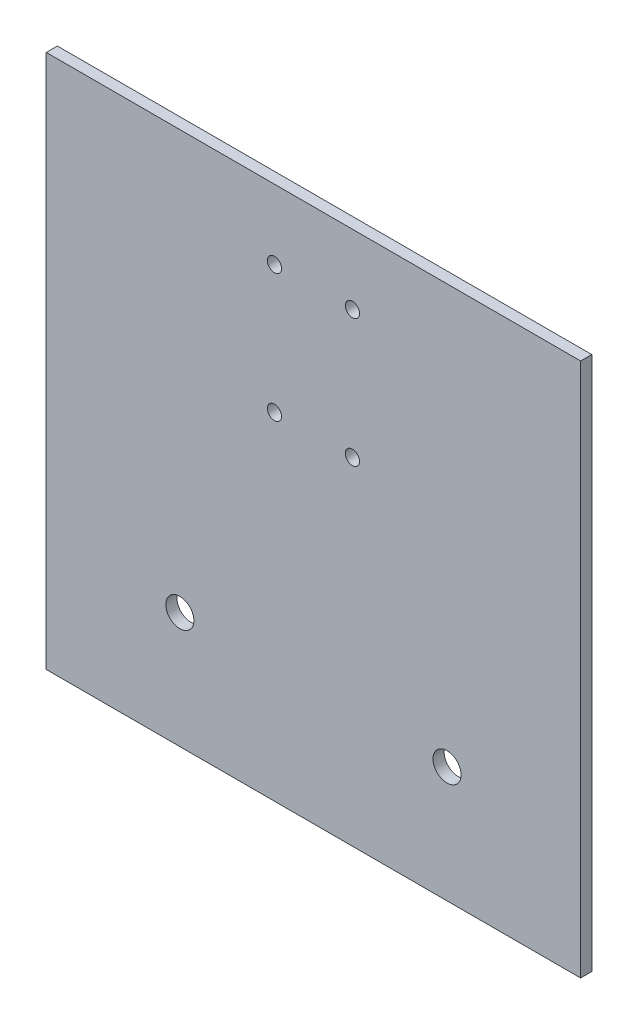
from build123d import *

# Parameters (mm, degrees)
SKETCH1_W               = 152.4
SKETCH1_H               = 152.4
BOSS_EXTRUDE1_DEPTH     = 3.175
CUT_EXTRUDE2_DEPTH      = 2.54
CUT_EXTRUDE2_DEPTH_BACK = 42.418
SKETCH2_R               = 2.032
SKETCH2_5_R             = 4
CUT_EXTRUDE3_DEPTH      = 42.418


with BuildPart() as part:
    # Sketch1 → Boss-Extrude1 (new body)
    with BuildSketch(Plane.XY):
        Rectangle(SKETCH1_W, SKETCH1_H)
    extrude(amount=BOSS_EXTRUDE1_DEPTH)

    # Sketch2 → Cut-Extrude2 (cut, two sides: drawn at the far end of the back side and taken through both)
    with BuildSketch(Plane.XY.offset(3.175).offset(-CUT_EXTRUDE2_DEPTH_BACK)):
        with Locations((-11.1125, 56.3626)):
            Circle(SKETCH2_R)
        with Locations((11.1125, 56.3626)):
            Circle(SKETCH2_R)
        with Locations((11.1125, 19.8374)):
            Circle(SKETCH2_R)
        with Locations((-11.1125, 19.8374)):
            Circle(SKETCH2_R)
    extrude(amount=CUT_EXTRUDE2_DEPTH + CUT_EXTRUDE2_DEPTH_BACK, mode=Mode.SUBTRACT)

    # Sketch2<5> → Cut-Extrude3 (cut)
    with BuildSketch(Plane.XY.offset(3.175)):
        with Locations((-38.1, -43.095115681)):
            Circle(SKETCH2_5_R)
        with Locations((38.1, -43.095115681)):
            Circle(SKETCH2_5_R)
    extrude(amount=-CUT_EXTRUDE3_DEPTH, mode=Mode.SUBTRACT)


solid = part.part
